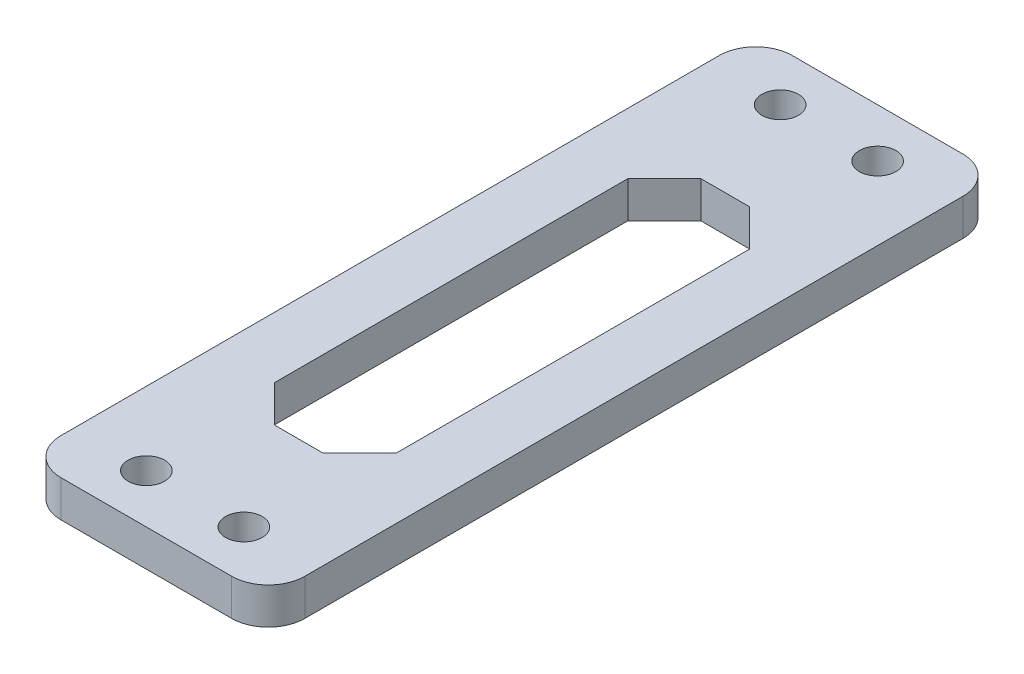
from build123d import *

# Parameters (mm, degrees)
SKETCH_1_W      = 20
SKETCH_1_H      = 60
SKETCH_1_R      = 1.5
SKETCH_1_W_2    = 10
SKETCH_1_H_2    = 35
EXTRUDE_1_DEPTH = 3
CHAMFER_1_SIZE  = 3
FILLET_1_R      = 3


with BuildPart() as part:
    # 草图1 → 凸台-拉伸1 (new body)
    with BuildSketch(Plane(origin=(0, 0, 0), x_dir=(1, 0, 0), z_dir=(0, 1, 0))):
        Rectangle(SKETCH_1_W, SKETCH_1_H)
        with Locations(Location((-4, 26, 0), (0, 0, 270))):
            Circle(SKETCH_1_R, mode=Mode.SUBTRACT)
        with Locations(Location((4, 26, 0), (0, 0, 90))):
            Circle(SKETCH_1_R, mode=Mode.SUBTRACT)
        with Locations(Location((4, -26, 0), (0, 0, 270))):
            Circle(SKETCH_1_R, mode=Mode.SUBTRACT)
        with Locations(Location((-4, -26, 0), (0, 0, 90))):
            Circle(SKETCH_1_R, mode=Mode.SUBTRACT)
        Rectangle(SKETCH_1_W_2, SKETCH_1_H_2, mode=Mode.SUBTRACT)
    extrude(amount=EXTRUDE_1_DEPTH)

    # 倒角1
    chamfer_1_edges = [part.edges().sort_by_distance(p)[0] for p in [
        (5, 1.5, 17.5),
        (5, 1.5, -17.5),
        (-5, 1.5, -17.5),
        (-5, 1.5, 17.5),
    ]]
    chamfer(chamfer_1_edges, length=CHAMFER_1_SIZE)

    # 圆角1
    fillet_1_edges = [part.edges().sort_by_distance(p)[0] for p in [
        (10, 1.5, 30),
        (-10, 1.5, 30),
        (-10, 1.5, -30),
        (10, 1.5, -30),
    ]]
    fillet(fillet_1_edges, radius=FILLET_1_R)


solid = part.part
